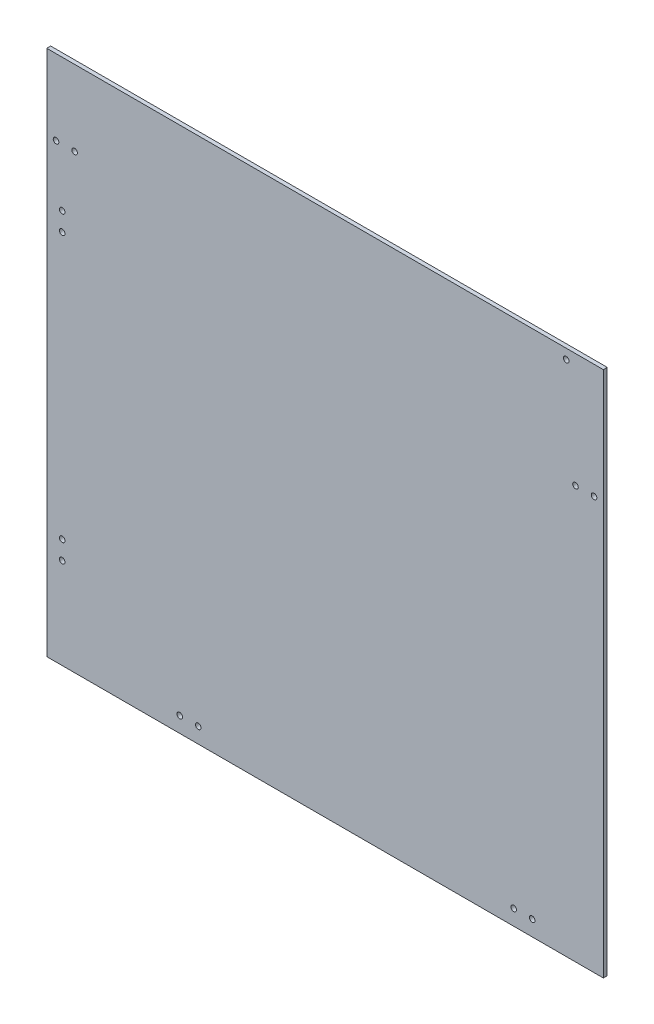
from build123d import *

# Parameters (mm, degrees)
SKETCH1_W           = 450
SKETCH1_H           = 426
BOSS_EXTRUDE1_DEPTH = 3.175
SKETCH8_R           = 2.25
CUT_EXTRUDE7_DEPTH  = 620.666104144
SKETCH2_R           = 2.25
CUT_EXTRUDE1_DEPTH  = 620.666104144
SKETCH3_R           = 2.25
CUT_EXTRUDE2_DEPTH  = 620.666104144
SKETCH5_R           = 2.25
CUT_EXTRUDE4_DEPTH  = 620.666104144
SKETCH7_R           = 2.25
CUT_EXTRUDE6_DEPTH  = 620.666104144


with BuildPart() as part:
    # Sketch1 → Boss-Extrude1 (new body)
    with BuildSketch(Plane.XY):
        with Locations((225, 213)):
            Rectangle(SKETCH1_W, SKETCH1_H)
    extrude(amount=BOSS_EXTRUDE1_DEPTH)

    # Sketch8 → Cut-Extrude7 (cut, through all)
    with BuildSketch(Plane(origin=(0, 0, 0), x_dir=(-1, 0, 0), z_dir=(0, 0, -1))):
        with Locations((-420, 418)):
            Circle(SKETCH8_R)
    extrude(amount=-CUT_EXTRUDE7_DEPTH, mode=Mode.SUBTRACT)

    # Sketch2 → Cut-Extrude1 (cut, through all)
    with BuildSketch(Plane.XY.offset(3.175)):
        with Locations((427.5, 333.5)):
            Circle(SKETCH2_R)
        with Locations((442.5, 333.5)):
            Circle(SKETCH2_R)
    extrude(amount=-CUT_EXTRUDE1_DEPTH, mode=Mode.SUBTRACT)

    # Sketch3 → Cut-Extrude2 (cut, through all)
    with BuildSketch(Plane.XY.offset(3.175)):
        with Locations((7.5, 365.055)):
            Circle(SKETCH3_R)
        with Locations((22.5, 365.055)):
            Circle(SKETCH3_R)
    extrude(amount=-CUT_EXTRUDE2_DEPTH, mode=Mode.SUBTRACT)

    # Sketch5 → Cut-Extrude4 (cut, through all)
    with BuildSketch(Plane.XY.offset(3.175)):
        with Locations((377.5, 12.5)):
            Circle(SKETCH5_R)
        with Locations((122.5, 12.5)):
            Circle(SKETCH5_R)
        with Locations((107.5, 12.5)):
            Circle(SKETCH5_R)
        with Locations((392.5, 12.5)):
            Circle(SKETCH5_R)
    extrude(amount=-CUT_EXTRUDE4_DEPTH, mode=Mode.SUBTRACT)

    # Sketch7 → Cut-Extrude6 (cut, through all)
    with BuildSketch(Plane.XY.offset(3.175)):
        with Locations((12.5, 303.5)):
            Circle(SKETCH7_R)
        with Locations((12.5, 318.5)):
            Circle(SKETCH7_R)
        with Locations((12.5, 73.5)):
            Circle(SKETCH7_R)
        with Locations((12.5, 88.5)):
            Circle(SKETCH7_R)
    extrude(amount=-CUT_EXTRUDE6_DEPTH, mode=Mode.SUBTRACT)


solid = part.part
